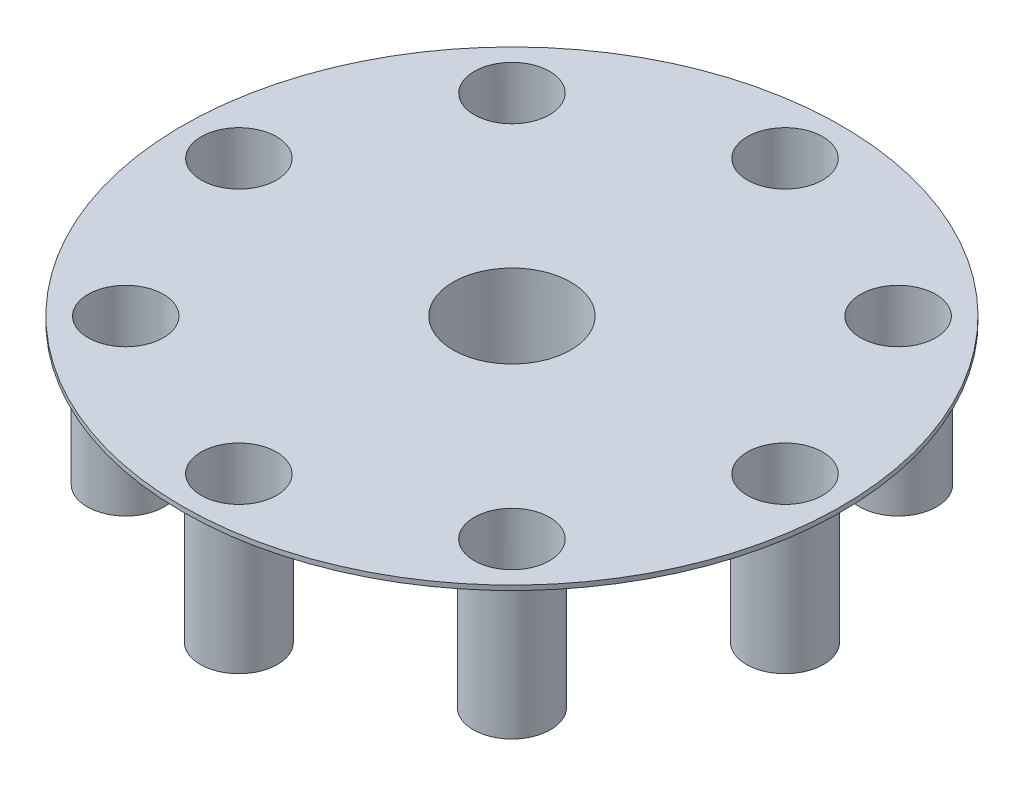
from build123d import *
from build123d.topology import SkipClean

# Parameters (mm, degrees)
SKETCH1_R                = 350
BOSS_EXTRUDE1_DEPTH      = 5
SKETCH3_R                = 62.5
CUT_EXTRUDE2_DEPTH       = 496
SKETCH2_R                = 40
CUT_EXTRUDE1_DEPTH       = 5
SURFACE_EXTRUDE2_1_DEPTH = 150
THICKEN2_T2              = 1
CIRPATTERN4_COUNT        = 8
CIRPATTERN6_COUNT        = 8
SURFACE_EXTRUDE3_2_DEPTH = 100
THICKEN3_T2              = 1


with BuildPart() as part:
    # Sketch1 → Boss-Extrude1 (new body)
    with BuildSketch(Plane(origin=(0, 0, 0), x_dir=(1, 0, 0), z_dir=(0, 1, 0))):
        with Locations(Location((0, 0, 0), (0, 0, 270))):
            Circle(SKETCH1_R)
    extrude(amount=BOSS_EXTRUDE1_DEPTH)

    # Sketch3 → Cut-Extrude2 (cut, through all)
    with BuildSketch(Plane(origin=(0, 5, 0), x_dir=(1, 0, 0), z_dir=(0, 1, 0))):
        with Locations(Location((0, 0, 0), (0, 0, 270))):
            Circle(SKETCH3_R)
    extrude(amount=-CUT_EXTRUDE2_DEPTH, mode=Mode.SUBTRACT)

    # Sketch2 → Cut-Extrude1 (cut)
    with BuildSketch(Plane(origin=(0, 5, 0), x_dir=(1, 0, 0), z_dir=(0, 1, 0))):
        with Locations(Location((0, 290, 0), (0, 0, 270))):
            Circle(SKETCH2_R)
    cut_extrude1 = extrude(amount=-CUT_EXTRUDE1_DEPTH, mode=Mode.SUBTRACT)

    # Surface-Extrude2: a surface, the sketch's curves swept straight by 150 mm
    with SkipClean():  # the faces are left unmerged after this step: merging them gives an invalid solid
        with BuildLine(Plane.XZ, mode=Mode.PRIVATE) as surface_extrude2_1_path:
            CenterArc((0, -290), 40, 0, 360)
        surface_extrude2_1 = Shell.extrude(surface_extrude2_1_path.wire(), (0 * SURFACE_EXTRUDE2_1_DEPTH, -1 * SURFACE_EXTRUDE2_1_DEPTH, 0 * SURFACE_EXTRUDE2_1_DEPTH))
        add(Solid.thicken(surface_extrude2_1, -THICKEN2_T2))

    # CirPattern4: Cut-Extrude1 ×8 about axis
    with SkipClean():  # the faces are left unmerged after this step: merging them gives an invalid solid
        cirpattern4_axis = Axis((0, 5, 0), (0, 1, 0))
        for i in range(1, CIRPATTERN4_COUNT):
            add(cut_extrude1.rotate(cirpattern4_axis, i * 360 / CIRPATTERN4_COUNT), mode=Mode.SUBTRACT)


with BuildPart() as cirpattern6_1:
    # CirPattern6: pattern copy
    add(part.part.rotate(Axis((0, 0, 0), (0, 1, 0)), 1 * 360 / CIRPATTERN6_COUNT))


with BuildPart() as cirpattern6_2:
    # CirPattern6: pattern copy
    add(part.part.rotate(Axis((0, 0, 0), (0, 1, 0)), 2 * 360 / CIRPATTERN6_COUNT))


with BuildPart() as cirpattern6_3:
    # CirPattern6: pattern copy
    add(part.part.rotate(Axis((0, 0, 0), (0, 1, 0)), 3 * 360 / CIRPATTERN6_COUNT))


with BuildPart() as cirpattern6_4:
    # CirPattern6: pattern copy
    add(part.part.rotate(Axis((0, 0, 0), (0, 1, 0)), 4 * 360 / CIRPATTERN6_COUNT))


with BuildPart() as cirpattern6_5:
    # CirPattern6: pattern copy
    add(part.part.rotate(Axis((0, 0, 0), (0, 1, 0)), 5 * 360 / CIRPATTERN6_COUNT))


with BuildPart() as cirpattern6_6:
    # CirPattern6: pattern copy
    add(part.part.rotate(Axis((0, 0, 0), (0, 1, 0)), 6 * 360 / CIRPATTERN6_COUNT))


with BuildPart() as cirpattern6_7:
    # CirPattern6: pattern copy
    add(part.part.rotate(Axis((0, 0, 0), (0, 1, 0)), 7 * 360 / CIRPATTERN6_COUNT))


with BuildPart() as part_1:
    with SkipClean():  # the faces are left unmerged after this step: merging them gives an invalid solid
        add(part.part)

        add(cirpattern6_1.part)  # Thicken3 merges CirPattern6_1

        add(cirpattern6_2.part)  # Thicken3 merges CirPattern6_2

        add(cirpattern6_3.part)  # Thicken3 merges CirPattern6_3

        add(cirpattern6_4.part)  # Thicken3 merges CirPattern6_4

        add(cirpattern6_5.part)  # Thicken3 merges CirPattern6_5

        add(cirpattern6_6.part)  # Thicken3 merges CirPattern6_6

        add(cirpattern6_7.part)  # Thicken3 merges CirPattern6_7
        # Surface-Extrude3: a surface, the sketch's curves swept straight by 100 mm
        with BuildLine(Plane.XZ, mode=Mode.PRIVATE) as surface_extrude3_2_path:
            CenterArc((0, 0), 62.5, 0, 360)
        surface_extrude3_2 = Shell.extrude(surface_extrude3_2_path.wire(), (0 * SURFACE_EXTRUDE3_2_DEPTH, -1 * SURFACE_EXTRUDE3_2_DEPTH, 0 * SURFACE_EXTRUDE3_2_DEPTH))
        add(Solid.thicken(surface_extrude3_2, -THICKEN3_T2))


solid = part_1.part
